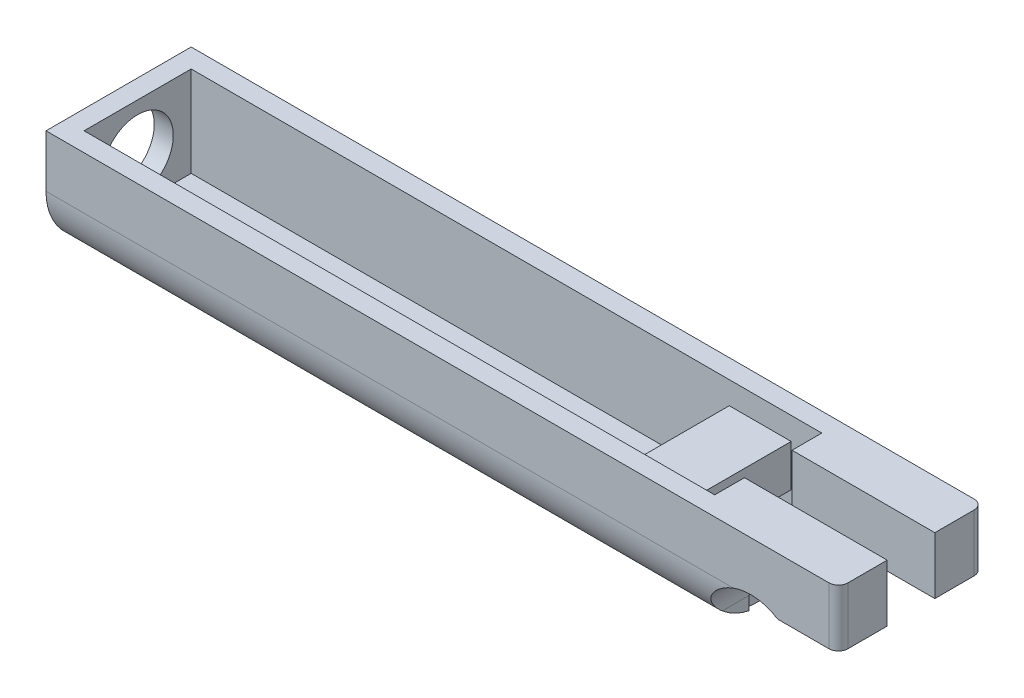
from build123d import *

# Parameters (mm, degrees)
SKETCH1_W           = 166.5
SKETCH1_H           = 30.5
BOSS_EXTRUDE1_DEPTH = 24
SKETCH2_W           = 30
SKETCH2_H           = 10
CUT_EXTRUDE1_DEPTH  = 123.108559222
CUT_EXTRUDE2_DEPTH  = 118.768839527
FILLET1_R           = 2
FILLET2_R           = 13
SKETCH5_W           = 132.5
SKETCH5_H           = 22.5
CUT_EXTRUDE3_DEPTH  = 19
SKETCH6_R           = 7.5
CUT_EXTRUDE4_DEPTH  = 4
SKETCH7_W           = 13
SKETCH7_H           = 8.8
BOSS_EXTRUDE2_DEPTH = 22.5
SKETCH8_R           = 2
CUT_EXTRUDE5_DEPTH  = 13


with BuildPart() as part:
    # Sketch1 → Boss-Extrude1 (new body)
    with BuildSketch(Plane(origin=(0, 0, 0), x_dir=(1, 0, 0), z_dir=(0, 1, 0))):
        with Locations((-27.940150479, -29.14876881)):
            Rectangle(SKETCH1_W, SKETCH1_H)
    extrude(amount=BOSS_EXTRUDE1_DEPTH)

    # Sketch2 → Cut-Extrude1 (cut, through all)
    with BuildSketch(Plane.XZ):
        with Locations((40.309849521, 29.14876881)):
            Rectangle(SKETCH2_W, SKETCH2_H)
    extrude(amount=-CUT_EXTRUDE1_DEPTH, mode=Mode.SUBTRACT)

    # Sketch4 → Cut-Extrude2 (cut, through all)
    with BuildSketch(Plane(origin=(0, 0, 13.89876881), x_dir=(-1, 0, 0), z_dir=(0, 0, -1))):
        with BuildLine():
            Line((-26.315186332, 3.097371167), (-26.315186332, 0))
            Line((-26.315186332, 0), (-55.309849521, 0))
            Line((-55.309849521, 0), (-55.309849521, 12))
            Line((-55.309849521, 12), (-42.521374472, 12))
            ThreePointArc((-42.521374472, 12), (-31.784812397, 12.342604184), (-26.315186332, 3.097371167))
        make_face()
    extrude(amount=-CUT_EXTRUDE2_DEPTH, mode=Mode.SUBTRACT)

    # Fillet1
    fillet1_edges = [part.edges().sort_by_distance(p)[0] for p in [
        (55.309849521, 18, 44.39876881),
        (55.309849521, 18, 13.89876881),
    ]]
    fillet(fillet1_edges, radius=FILLET1_R)

    # Fillet2
    fillet2_edges = [part.edges().sort_by_distance(p)[0] for p in [
        (-42.437482073, 0, 44.39876881),
        (-42.437482073, 0, 13.89876881),
    ]]
    fillet(fillet2_edges, radius=FILLET2_R)

    # Sketch5 → Cut-Extrude3 (cut)
    with BuildSketch(Plane(origin=(0, 24, 0), x_dir=(1, 0, 0), z_dir=(0, 1, 0))):
        with Locations((-40.940150479, -29.14876881)):
            Rectangle(SKETCH5_W, SKETCH5_H)
    extrude(amount=-CUT_EXTRUDE3_DEPTH, mode=Mode.SUBTRACT)

    # Sketch6 → Cut-Extrude4 (cut)
    with BuildSketch(Plane.ZY.offset(111.190150479)):
        with Locations((29.14876881, 13.8)):
            Circle(SKETCH6_R)
    extrude(amount=-CUT_EXTRUDE4_DEPTH, mode=Mode.SUBTRACT)

    # Sketch7 → Boss-Extrude2 (add)
    with BuildSketch(Plane(origin=(0, 0, 40.39876881), x_dir=(-1, 0, 0), z_dir=(0, 0, -1))):
        with Locations((-12.376968122, 14.857402626)):
            Rectangle(SKETCH7_W, SKETCH7_H)
    extrude(amount=BOSS_EXTRUDE2_DEPTH)

    # Sketch8 → Cut-Extrude5 (cut)
    with BuildSketch(Plane(origin=(18.876968122, 0, 0), x_dir=(0, 0, -1), z_dir=(1, 0, 0))):
        with Locations((-29.14876881, 13.8)):
            Circle(SKETCH8_R)
    extrude(amount=-CUT_EXTRUDE5_DEPTH, mode=Mode.SUBTRACT)


solid = part.part
